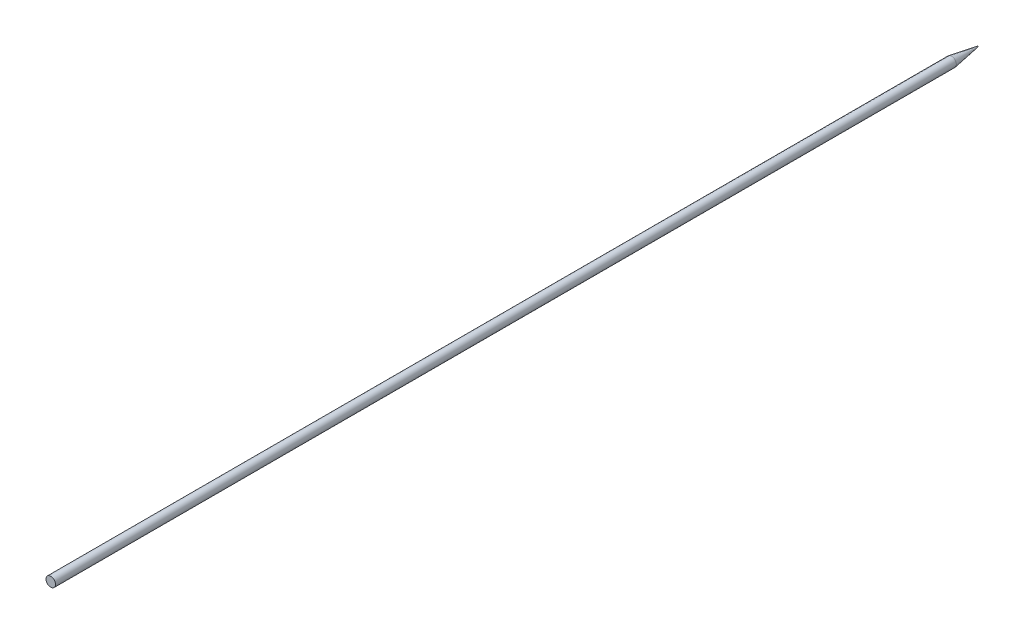
from build123d import *


with BuildPart() as part:
    # Sketch1 → Revolve1 (revolve)
    with BuildSketch(Plane(origin=(0, 0, 0), x_dir=(1, 0, 0), z_dir=(0, 1, 0))):
        with BuildLine():
            Line((0, 0), (0, 5.529574143))
            add(Edge.make_bspline(
                [(0, 5.529574143), (0.072188462, 5.526516627), (0.093305311, 5.44016813)],
                knots=[0, 0, 0, 1, 1, 1], degree=2))
            Line((0.093305311, 5.44016813), (1, 3.58e-07))
            Line((1, 3.58e-07), (1, -189.470425857))
            Line((1, -189.470425857), (0, -189.470425857))
            Line((0, -189.470425857), (0, 0))
        make_face()
    revolve(axis=Axis((0, 0, 0), (0, 0, -1)))


solid = part.part
